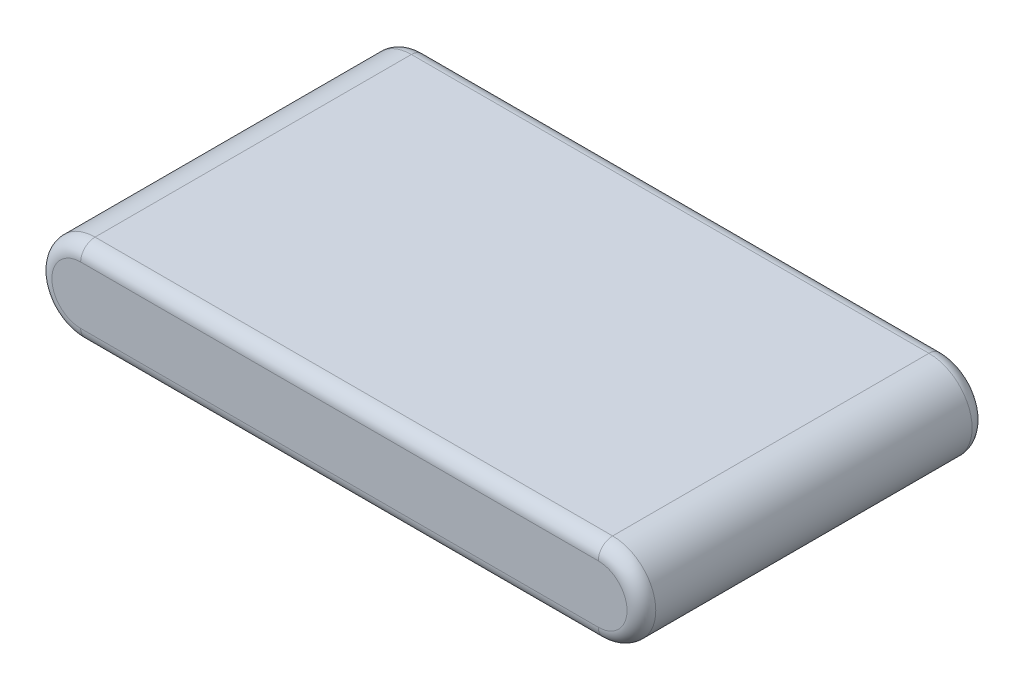
from build123d import *

# Parameters (mm, degrees)
RESSALTO_EXTRUS_O1_DEPTH = 12
FILETE1_R                = 0.5


with BuildPart() as part:
    # Esboço1 → Ressalto-extrusão1 (new body)
    with BuildSketch(Plane.XY):
        with BuildLine():
            Line((9, 1.5), (-9, 1.5))
            ThreePointArc((-9, 1.5), (-10.5, 0), (-9, -1.5))
            Line((-9, -1.5), (9, -1.5))
            ThreePointArc((9, -1.5), (10.5, 0), (9, 1.5))
        make_face()
    extrude(amount=RESSALTO_EXTRUS_O1_DEPTH)

    # Filete1
    filete1_edges = [part.edges().sort_by_distance(p)[0] for p in [
        (-10.5, 0, 12),
        (0, -1.5, 12),
        (10.5, 0, 12),
        (0, -1.5, 0),
        (-10.5, 0, 0),
        (0, 1.5, 0),
        (10.5, 0, 0),
        (0, 1.5, 12),
    ]]
    fillet(filete1_edges, radius=FILETE1_R)


solid = part.part
